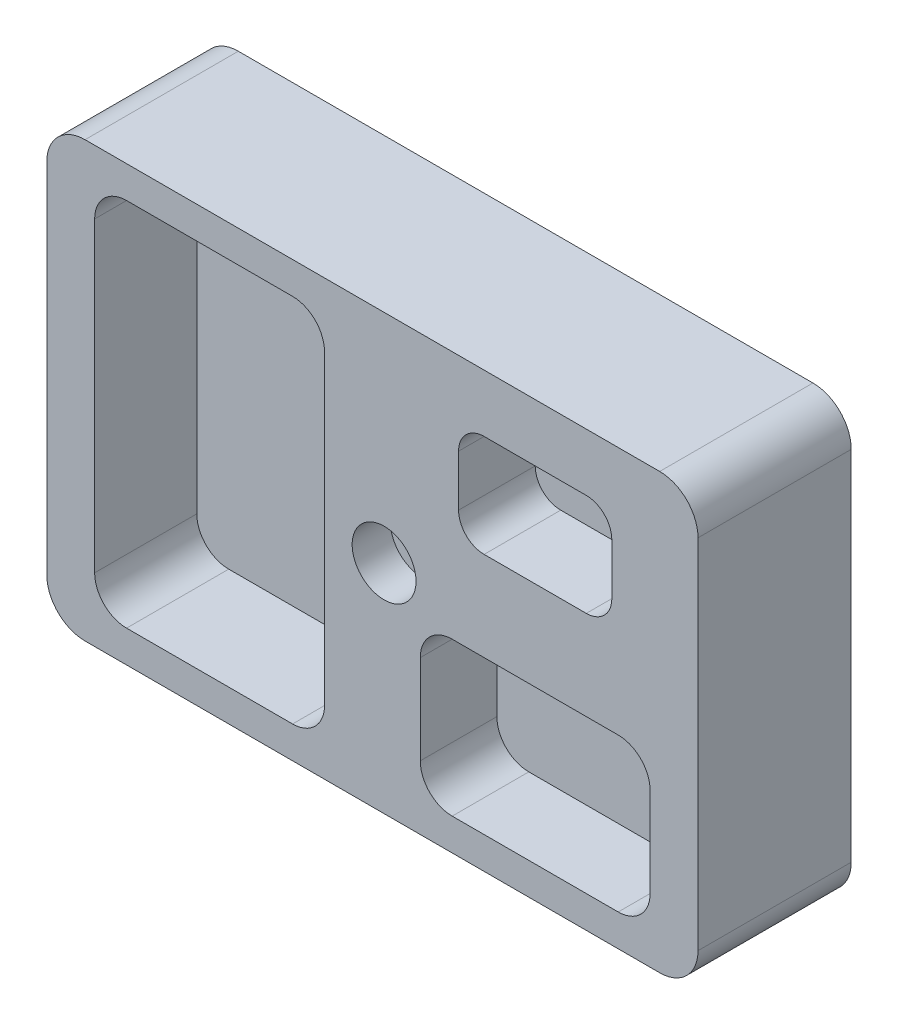
from build123d import *

# Parameters (mm, degrees)
SKETCH1_W                                        = 161.925
SKETCH1_H                                        = 107.95
BOSS_EXTRUDE1_DEPTH                              = 38.1
SKETCH2_W                                        = 57.15
SKETCH2_H                                        = 92.075
CUT_EXTRUDE1_DEPTH                               = 25.4
FILLET1_R                                        = 7.9375
SKETCH3_W                                        = 57.15
SKETCH3_H                                        = 38.1
SKETCH3_W_2                                      = 38.1
SKETCH3_H_2                                      = 25.4
CUT_EXTRUDE2_DEPTH                               = 19.05
FILLET2_R                                        = 6.35
FILLET3_R                                        = 7.9375
FILLET4_R                                        = 9.525
CBORE_FOR_3_8_SOCKET_HEAD_CAP_SCREW1_D           = 10.0838
CBORE_FOR_3_8_SOCKET_HEAD_CAP_SCREW1_CBORE_D     = 15.875
CBORE_FOR_3_8_SOCKET_HEAD_CAP_SCREW1_CBORE_DEPTH = 9.525


with BuildPart() as part:
    # Sketch1 → Boss-Extrude1 (new body)
    with BuildSketch(Plane.XY):
        Rectangle(SKETCH1_W, SKETCH1_H)
    extrude(amount=-BOSS_EXTRUDE1_DEPTH)

    # Sketch2 → Cut-Extrude1 (cut)
    with BuildSketch(Plane.XY):
        with Locations((-40.48125, 0)):
            Rectangle(SKETCH2_W, SKETCH2_H)
    extrude(amount=-CUT_EXTRUDE1_DEPTH, mode=Mode.SUBTRACT)

    # Fillet1
    fillet1_edges = [part.edges().sort_by_distance(p)[0] for p in [
        (-11.90625, 46.0375, -12.7),
        (-11.90625, -46.0375, -12.7),
        (-69.05625, -46.0375, -12.7),
        (-69.05625, 46.0375, -12.7),
    ]]
    fillet(fillet1_edges, radius=FILLET1_R)

    # Sketch3 → Cut-Extrude2 (cut)
    with BuildSketch(Plane.XY):
        with Locations((40.48125, -26.9875)):
            Rectangle(SKETCH3_W, SKETCH3_H)
        with Locations((40.48125, 26.9875)):
            Rectangle(SKETCH3_W_2, SKETCH3_H_2)
    extrude(amount=-CUT_EXTRUDE2_DEPTH, mode=Mode.SUBTRACT)

    # Fillet2
    fillet2_edges = [part.edges().sort_by_distance(p)[0] for p in [
        (59.53125, 39.6875, -9.525),
        (59.53125, 14.2875, -9.525),
        (21.43125, 14.2875, -9.525),
        (21.43125, 39.6875, -9.525),
    ]]
    fillet(fillet2_edges, radius=FILLET2_R)

    # Fillet3
    fillet3_edges = [part.edges().sort_by_distance(p)[0] for p in [
        (69.05625, -7.9375, -9.525),
        (69.05625, -46.0375, -9.525),
        (11.90625, -46.0375, -9.525),
        (11.90625, -7.9375, -9.525),
    ]]
    fillet(fillet3_edges, radius=FILLET3_R)

    # Fillet4
    fillet4_edges = [part.edges().sort_by_distance(p)[0] for p in [
        (80.9625, -53.975, -19.05),
        (-80.9625, -53.975, -19.05),
        (-80.9625, 53.975, -19.05),
        (80.9625, 53.975, -19.05),
    ]]
    fillet(fillet4_edges, radius=FILLET4_R)

    # CBORE for 3/8 Socket Head Cap Screw1 (through all)
    with Locations(Plane.XY):
        with Locations((2.910260727, 0)):
            CounterBoreHole(CBORE_FOR_3_8_SOCKET_HEAD_CAP_SCREW1_D / 2, CBORE_FOR_3_8_SOCKET_HEAD_CAP_SCREW1_CBORE_D / 2, CBORE_FOR_3_8_SOCKET_HEAD_CAP_SCREW1_CBORE_DEPTH)


solid = part.part
